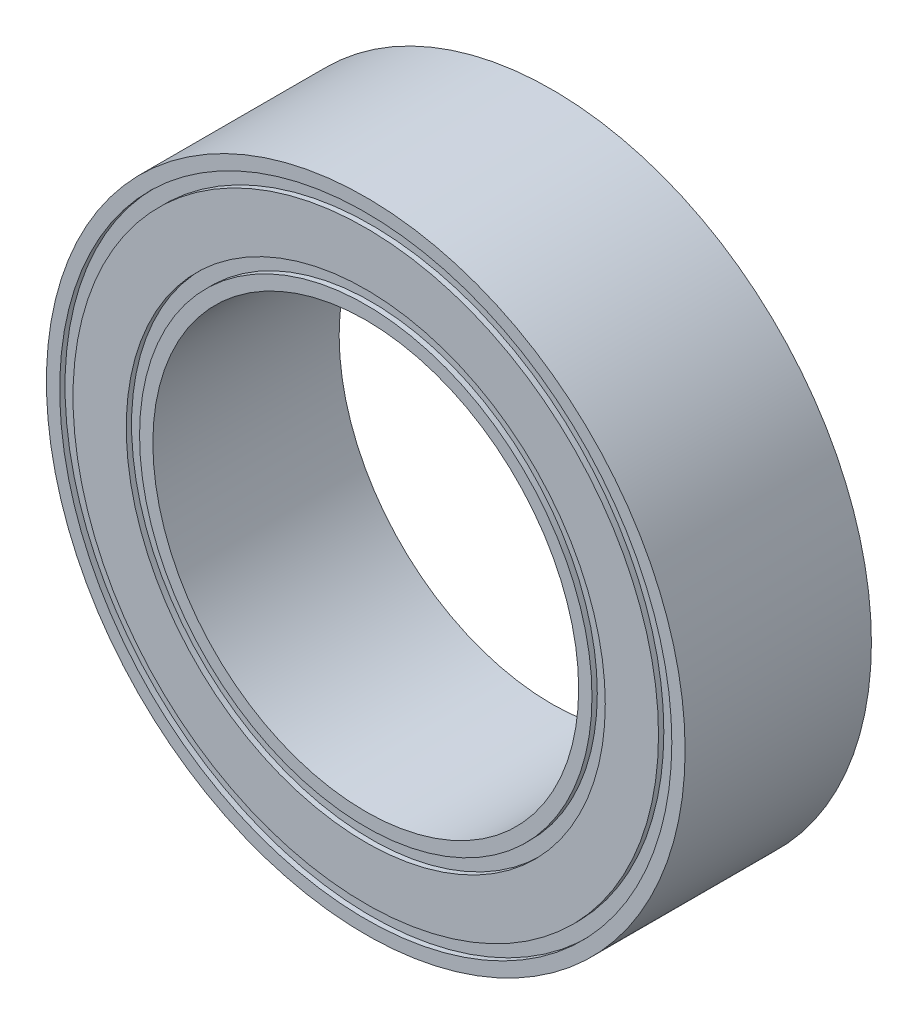
from build123d import *

# Parameters (mm, degrees)
SKETCH_1_R          = 6
SKETCH_1_R_2        = 4
EXTRUDE_1_DEPTH     = 3.5
SKETCH_2_R          = 5.75
SKETCH_2_R_2        = 5.5
SKETCH_2_R_3        = 4.5
SKETCH_2_R_4        = 4.25
CUT_EXTRUDE_1_DEPTH = 0.1
CUT_EXTRUDE_START   = -0.1
SKETCH_3_R          = 5.75
SKETCH_3_R_2        = 5.5
SKETCH_3_R_3        = 4.5
SKETCH_3_R_4        = 4.25
CUT_EXTRUDE_2_DEPTH = 0.1


with BuildPart() as part:
    # 草图1 → 凸台-拉伸1 (new body)
    with BuildSketch(Plane.XY):
        Circle(SKETCH_1_R)
        Circle(SKETCH_1_R_2, mode=Mode.SUBTRACT)
    extrude(amount=EXTRUDE_1_DEPTH)

    # 草图2 → 切除-拉伸1 (cut)
    # profile 1 of 2: a face of its own
    with BuildSketch(Plane.XY.offset(3.5)):
        Circle(SKETCH_2_R)
        Circle(SKETCH_2_R_2, mode=Mode.SUBTRACT)
    # profile 2 of 2: a face of its own
    with BuildSketch(Plane.XY.offset(3.5)):
        Circle(SKETCH_2_R_3)
        Circle(SKETCH_2_R_4, mode=Mode.SUBTRACT)
    extrude(amount=-CUT_EXTRUDE_1_DEPTH, mode=Mode.SUBTRACT)

    # 草图3 → 切除-拉伸2 (cut)
    # profile 1 of 2: a face of its own
    with BuildSketch(Plane(origin=(0, 0, 0), x_dir=(-1, 0, 0), z_dir=(0, 0, -1)).offset(CUT_EXTRUDE_START)):
        with Locations(Location((0, 0, 0), (0, 0, 180))):
            Circle(SKETCH_3_R)
        with Locations(Location((0, 0, 0), (0, 0, 180))):
            Circle(SKETCH_3_R_2, mode=Mode.SUBTRACT)
    # profile 2 of 2: a face of its own
    with BuildSketch(Plane(origin=(0, 0, 0), x_dir=(-1, 0, 0), z_dir=(0, 0, -1)).offset(CUT_EXTRUDE_START)):
        with Locations(Location((0, 0, 0), (0, 0, 180))):
            Circle(SKETCH_3_R_3)
        with Locations(Location((0, 0, 0), (0, 0, 180))):
            Circle(SKETCH_3_R_4, mode=Mode.SUBTRACT)
    extrude(amount=CUT_EXTRUDE_2_DEPTH, mode=Mode.SUBTRACT)


solid = part.part
